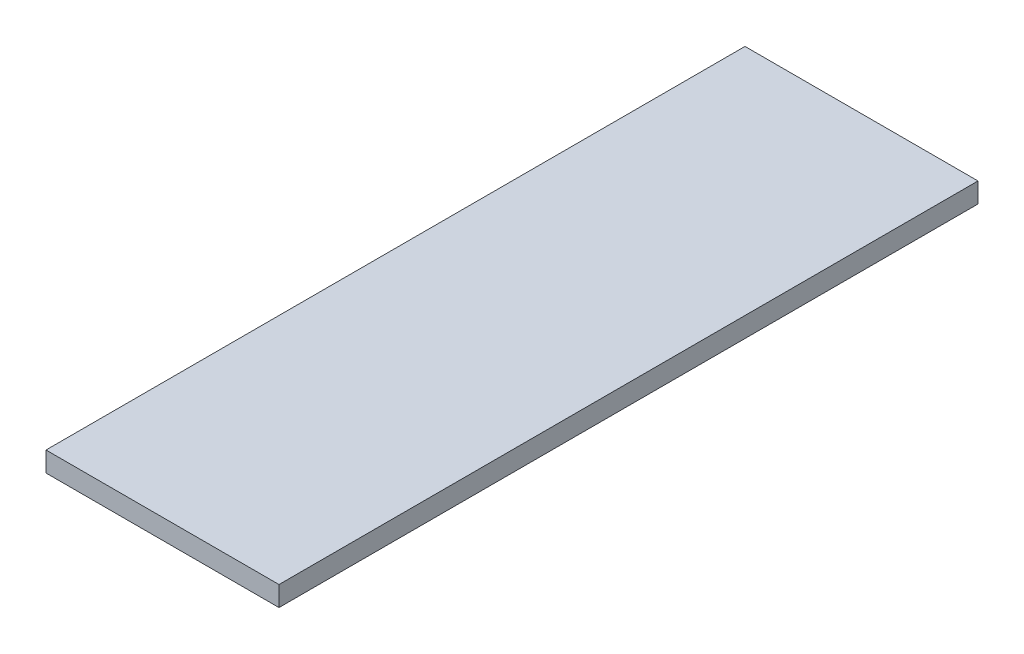
from build123d import *

# Parameters (mm, degrees)
SKETCH1_W           = 35
SKETCH1_H           = 105
BOSS_EXTRUDE1_DEPTH = 3


with BuildPart() as part:
    # Sketch1 → Boss-Extrude1 (new body)
    with BuildSketch(Plane(origin=(0, 0, 0), x_dir=(1, 0, 0), z_dir=(0, 1, 0))):
        Rectangle(SKETCH1_W, SKETCH1_H)
    extrude(amount=BOSS_EXTRUDE1_DEPTH)


solid = part.part
